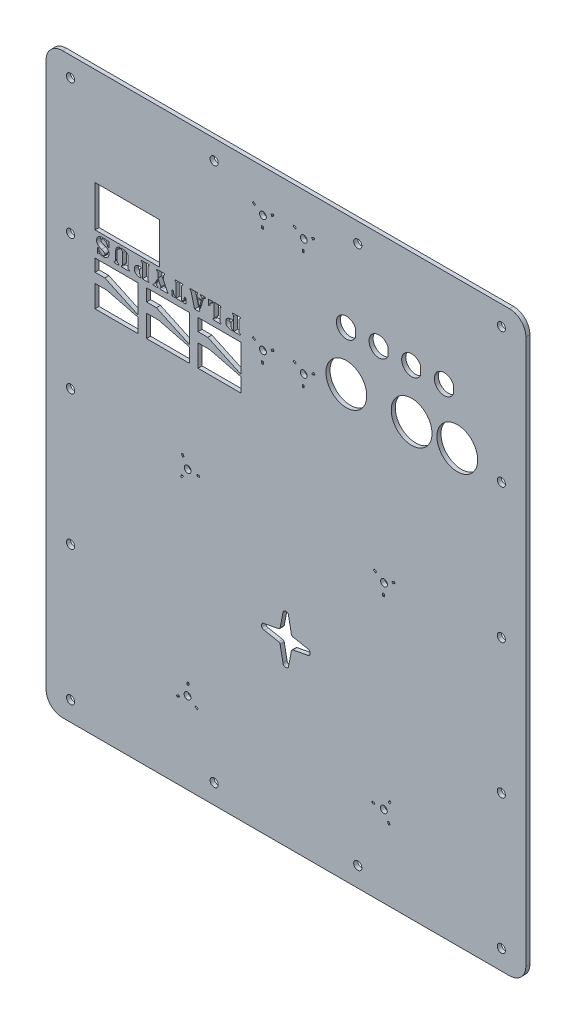
from build123d import *

# Parameters (mm, degrees)
BOSS_EXTRUDE1_DEPTH = 3.175
SKETCH4_R           = 3.175
CUT_EXTRUDE3_DEPTH  = 445.462966308
SKETCH5_W           = 49.9872
SKETCH5_H           = 31.9786
CUT_EXTRUDE4_DEPTH  = 445.462966308
SKETCH10_W          = 1.2954
SKETCH10_H          = 2.080551321
SKETCH10_R          = 2.6543
CUT_EXTRUDE8_DEPTH  = 302.960584479
SKETCH11_W          = 2.080551322
SKETCH11_H          = 1.2954
SKETCH11_W_2        = 1.2954
SKETCH11_H_2        = 2.080551321
SKETCH11_H_3        = 2.080551322
SKETCH11_R          = 2.6543
CUT_EXTRUDE9_DEPTH  = 302.960584479
CUT_EXTRUDE13_DEPTH = 303.360926012
CUT_EXTRUDE11_DEPTH = 445.462966308
SKETCH15_R          = 15.875
SKETCH15_R_2        = 12.7
CUT_EXTRUDE14_DEPTH = 445.462966442


with BuildPart() as part:
    # Sketch1 → Boss-Extrude1 (new body)
    with BuildSketch(Plane.XY):
        with BuildLine():
            Line((174.136860842, 46.306847874), (-173.843139158, 46.306847874))
            ThreePointArc((-173.843139158, 46.306847874), (-182.823395279, 42.587103995), (-186.543139158, 33.606847874))
            Line((-186.543139158, 33.606847874), (-186.543139158, -390.573152126))
            ThreePointArc((-186.543139158, -390.573152126), (-182.823395279, -399.553408247), (-173.843139158, -403.273152126))
            Line((-173.843139158, -403.273152126), (174.136860842, -403.273152126))
            ThreePointArc((174.136860842, -403.273152126), (183.117116963, -399.553408247), (186.836860842, -390.573152126))
            Line((186.836860842, -390.573152126), (186.836860842, 33.606847874))
            ThreePointArc((186.836860842, 33.606847874), (183.117116963, 42.587103995), (174.136860842, 46.306847874))
        make_face()
    extrude(amount=BOSS_EXTRUDE1_DEPTH)

    # Sketch4 → Cut-Extrude3 (cut, through all)
    with BuildSketch(Plane(origin=(0, 0, 0), x_dir=(-1, 0, 0), z_dir=(0, 0, -1))):
        with Locations((167.493139158, 31.066847874)):
            Circle(SKETCH4_R)
        with Locations((167.493139158, -73.708152126)):
            Circle(SKETCH4_R)
        with Locations((167.493139158, -178.483152126)):
            Circle(SKETCH4_R)
        with Locations((167.493139158, -283.258152126)):
            Circle(SKETCH4_R)
        with Locations((167.493139158, -388.033152126)):
            Circle(SKETCH4_R)
        with Locations((55.733139158, -388.033152126)):
            Circle(SKETCH4_R)
        with Locations((-56.026860842, -388.033152126)):
            Circle(SKETCH4_R)
        with Locations((-167.786860842, -388.033152126)):
            Circle(SKETCH4_R)
        with Locations((-167.786860842, -283.258152126)):
            Circle(SKETCH4_R)
        with Locations((-167.786860842, -178.483152126)):
            Circle(SKETCH4_R)
        with Locations((-167.786860842, -73.708152126)):
            Circle(SKETCH4_R)
        with Locations((-167.786860842, 31.066847874)):
            Circle(SKETCH4_R)
        with Locations((-56.026860842, 31.066847874)):
            Circle(SKETCH4_R)
        with Locations((55.733139158, 31.066847874)):
            Circle(SKETCH4_R)
    extrude(amount=-CUT_EXTRUDE3_DEPTH, mode=Mode.SUBTRACT)

    # Sketch5 → Cut-Extrude4 (cut, through all)
    with BuildSketch(Plane.XY.offset(3.175)):
        with Locations((-123.449539158, -45.882452126)):
            Rectangle(SKETCH5_W, SKETCH5_H)
    extrude(amount=-CUT_EXTRUDE4_DEPTH, mode=Mode.SUBTRACT)

    # Sketch10 → Cut-Extrude8 (cut, through all)
    with BuildSketch(Plane(origin=(13.706943598, -177.28638634, 3.175), x_dir=(1, 0, 0), z_dir=(0, 0, 1))):
        Polygon((-37.289591891, 195.125899909), (-39.091402189, 196.16617557), (-39.739102189, 195.044326262), (-37.937291891, 194.004050601), align=None)
        Polygon((-24.642895305, 193.322142198), (-22.841085006, 194.362417859), (-23.488785006, 195.484267167), (-25.290595305, 194.443991506), align=None)
        with Locations((-31.880643598, 182.231384875)):
            Rectangle(SKETCH10_W, SKETCH10_H)
        Polygon((-5.539591891, 195.125899909), (-7.341402189, 196.16617557), (-7.989102189, 195.044326262), (-6.187291891, 194.004050601), align=None)
        Polygon((7.107104695, 193.322142198), (8.908914994, 194.362417859), (8.261214994, 195.484267167), (6.459404695, 194.443991506), align=None)
        with Locations((-0.130643598, 182.231384875)):
            Rectangle(SKETCH10_W, SKETCH10_H)
        Polygon((-37.289591891, 104.066899909), (-39.091402189, 105.10717557), (-39.739102189, 103.985326262), (-37.937291891, 102.945050601), align=None)
        Polygon((-24.642895305, 102.263142198), (-22.841085006, 103.303417859), (-23.488785006, 104.425267167), (-25.290595305, 103.384991506), align=None)
        with Locations((-31.880643598, 91.172384876)):
            Rectangle(SKETCH10_W, SKETCH10_H)
        Polygon((-5.539591891, 104.066899909), (-7.341402189, 105.10717557), (-7.989102189, 103.985326262), (-6.187291891, 102.945050601), align=None)
        Polygon((7.107104695, 102.263142198), (8.908914994, 103.303417859), (8.261214994, 104.425267167), (6.459404695, 103.384991506), align=None)
        with Locations((-0.130643598, 91.172384876)):
            Rectangle(SKETCH10_W, SKETCH10_H)
        with Locations((-31.486943598, 190.573234215)):
            Circle(SKETCH10_R)
        with Locations((0.263056402, 190.573234215)):
            Circle(SKETCH10_R)
        with Locations((-31.486943598, 99.514234215)):
            Circle(SKETCH10_R)
        with Locations((0.263056402, 99.514234215)):
            Circle(SKETCH10_R)
    extrude(amount=-CUT_EXTRUDE8_DEPTH, mode=Mode.SUBTRACT)

    # Sketch11 → Cut-Extrude9 (cut, through all)
    with BuildSketch(Plane(origin=(13.706943598, -177.28638634, 3.175), x_dir=(1, 0, 0), z_dir=(0, 0, 1))):
        with BuildLine():
            ThreePointArc((-15.929443598, -103.063465785), (-13.706943598, -105.285965785), (-11.484443598, -103.063465785))
            Line((-11.484443598, -103.063465785), (-9.330021747, -91.872117682))
            ThreePointArc((-9.330021747, -91.872117682), (-8.911130221, -91.082579163), (-8.121591701, -90.663687637))
            Line((-8.121591701, -90.663687637), (3.069756402, -88.509265785))
            ThreePointArc((3.069756402, -88.509265785), (5.292256402, -86.286765785), (3.069756402, -84.064265785))
            Line((3.069756402, -84.064265785), (-8.121591701, -81.909843934))
            ThreePointArc((-8.121591701, -81.909843934), (-8.911130221, -81.490952408), (-9.330021747, -80.701413888))
            Line((-9.330021747, -80.701413888), (-11.484443598, -69.510065785))
            ThreePointArc((-11.484443598, -69.510065785), (-13.706943598, -67.287565785), (-15.929443598, -69.510065785))
            Line((-15.929443598, -69.510065785), (-18.083865449, -80.701413888))
            ThreePointArc((-18.083865449, -80.701413888), (-18.502756975, -81.490952408), (-19.292295495, -81.909843934))
            Line((-19.292295495, -81.909843934), (-30.483643598, -84.064265785))
            ThreePointArc((-30.483643598, -84.064265785), (-32.706143598, -86.286765785), (-30.483643598, -88.509265785))
            Line((-30.483643598, -88.509265785), (-19.292295495, -90.663687637))
            ThreePointArc((-19.292295495, -90.663687637), (-18.502756975, -91.082579163), (-18.083865449, -91.872117682))
            Line((-18.083865449, -91.872117682), (-15.929443598, -103.063465785))
        make_face()
        Polygon((-92.78802861, -2.963679621), (-93.828304271, -1.161869323), (-94.950153579, -1.809569323), (-93.909877919, -3.611379621), align=None)
        with Locations((-81.697271288, -10.201427914)):
            Rectangle(SKETCH11_W, SKETCH11_H)
        Polygon((-94.591786321, -15.610376207), (-95.632061982, -17.412186506), (-94.510212674, -18.059886506), (-93.469937013, -16.258076207), align=None)
        Polygon((56.96944598, -5.401923062), (55.167635682, -4.361647401), (54.519935682, -5.483496709), (56.32174598, -6.52377237), align=None)
        Polygon((69.616142566, -7.205680773), (71.417952865, -6.165405112), (70.770252865, -5.043555804), (68.968442566, -6.083831465), align=None)
        with Locations((62.378394273, -18.296438096)):
            Rectangle(SKETCH11_W_2, SKETCH11_H_2)
        Polygon((-97.030029762, -165.367850798), (-98.83184006, -166.408126459), (-98.18414006, -167.529975767), (-96.382329762, -166.489700106), align=None)
        Polygon((-84.383333176, -167.171608509), (-82.581522877, -168.21188417), (-81.933822877, -167.090034862), (-83.735633176, -166.049759201), align=None)
        with Locations((-89.792281469, -154.277093475)):
            Rectangle(SKETCH11_W_2, SKETCH11_H_3)
        with Locations((54.283384092, -162.372103656)):
            Rectangle(SKETCH11_W, SKETCH11_H)
        Polygon((67.177899126, -156.963155363), (68.218174787, -155.161345065), (67.096325479, -154.513645065), (66.056049818, -156.315455363), align=None)
        Polygon((65.374141415, -169.609851949), (66.414417076, -171.411662248), (67.536266384, -170.763962248), (66.495990723, -168.962151949), align=None)
        with Locations((-90.039120627, -9.807727914)):
            Circle(SKETCH11_R)
        with Locations((62.772094273, -9.954588756)):
            Circle(SKETCH11_R)
        with Locations((62.625233431, -162.765803656)):
            Circle(SKETCH11_R)
        with Locations((-90.185981469, -162.618942814)):
            Circle(SKETCH11_R)
    extrude(amount=-CUT_EXTRUDE9_DEPTH, mode=Mode.SUBTRACT)

    # Sketch14 → Cut-Extrude13 (cut, through all)
    with BuildSketch(Plane(origin=(13.706943598, -177.28638634, 15.875), x_dir=(1, 0, 0), z_dir=(0, 0, 1))):
        with BuildLine():
            ThreePointArc((128.806917244, 113.692643266), (109.756917244, 109.293234215), (128.806917244, 104.893825163))
            Line((128.806917244, 104.893825163), (128.806917244, 113.692643266))
        make_face()
        with BuildLine():
            ThreePointArc((116.665717244, 150.635691209), (101.882917244, 147.393234215), (116.665717244, 144.15077722))
            Line((116.665717244, 144.15077722), (116.665717244, 150.635691209))
        make_face()
        with BuildLine():
            ThreePointArc((91.265717244, 150.635691209), (76.482917244, 147.393234215), (91.265717244, 144.15077722))
            Line((91.265717244, 144.15077722), (91.265717244, 150.635691209))
        make_face()
        with BuildLine():
            ThreePointArc((93.246917244, 113.692643266), (74.196917244, 109.293234215), (93.246917244, 104.893825163))
            Line((93.246917244, 104.893825163), (93.246917244, 113.692643266))
        make_face()
        with BuildLine():
            ThreePointArc((65.865717244, 150.635691209), (51.082917244, 147.393234215), (65.865717244, 144.15077722))
            Line((65.865717244, 144.15077722), (65.865717244, 150.635691209))
        make_face()
        with BuildLine():
            ThreePointArc((40.465717244, 150.635691209), (25.682917244, 147.393234215), (40.465717244, 144.15077722))
            Line((40.465717244, 144.15077722), (40.465717244, 150.635691209))
        make_face()
        with BuildLine():
            ThreePointArc((42.446917244, 113.692643266), (23.396917244, 109.293234215), (42.446917244, 104.893825163))
            Line((42.446917244, 104.893825163), (42.446917244, 113.692643266))
        make_face()
    extrude(amount=-CUT_EXTRUDE13_DEPTH, mode=Mode.SUBTRACT)

    # Sketch12 → Cut-Extrude11 (cut, through all)
    with BuildSketch(Plane.XY.offset(3.175)):
        Polygon((-34.707986547, -102.505070352), (-34.707986547, -80.813584087), (-68.280739158, -80.813584087), (-68.280739158, -90.405799119), (-60.65056811, -90.405799119), align=None)
        Polygon((-59.015531457, -97.926967723), (-68.280739158, -97.926967723), (-68.280739158, -115.040351359), (-34.707986547, -115.040351359), (-34.707986547, -104.031104561), align=None)
        Polygon((-74.789186547, -102.505070352), (-74.789186547, -80.813584087), (-108.361939158, -80.813584087), (-108.361939158, -90.405799119), (-100.73176811, -90.405799119), align=None)
        Polygon((-99.096731457, -97.926967723), (-108.361939158, -97.926967723), (-108.361939158, -115.040351359), (-74.789186547, -115.040351359), (-74.789186547, -104.031104561), align=None)
        Polygon((-114.870386547, -102.505070352), (-114.870386547, -80.813584087), (-148.443139158, -80.813584087), (-148.443139158, -90.405799119), (-140.81296811, -90.405799119), align=None)
        Polygon((-139.177931457, -97.926967723), (-148.443139158, -97.926967723), (-148.443139158, -115.040351359), (-114.870386547, -115.040351359), (-114.870386547, -104.031104561), align=None)
        with BuildLine():
            Line((-41.380930274, -76.448998178), (-41.37923359, -75.567395974))
            add(Edge.make_bspline(
                [(-41.37923359, -75.567395974), (-41.437136071, -75.557701977), (-41.54803329, -75.539135635), (-41.703036219, -75.492711306), (-41.843810377, -75.442303078), (-41.969216532, -75.378732592), (-42.078802932, -75.303784527), (-42.175261163, -75.220661152), (-42.255562938, -75.126788015), (-42.339496939, -74.98650367), (-42.417921981, -74.79480065), (-42.487285082, -74.550414946), (-42.522325046, -74.287448485), (-42.521080582, -74.107533231), (-42.520442098, -74.015226011)],
                knots=[0, 0, 0, 0, 0.975945456, 1.869170967, 2.688106615, 3.46168993, 4.201177763, 4.892431363, 5.575190918, 6.246583884, 7.604214601, 9.008390706, 10.465126602, 12, 12, 12, 12], degree=3))
            Line((-42.520442098, -74.015226011), (-42.520439808, -71.516336462))
            add(Edge.make_bspline(
                [(-42.520439808, -71.516336462), (-42.523235931, -71.416893662), (-42.528636543, -71.224823426), (-42.503647924, -70.944871252), (-42.445377589, -70.687007787), (-42.381227175, -70.48329237), (-42.302526908, -70.336823994), (-42.226376941, -70.235732165), (-42.128686737, -70.14770687), (-42.014871792, -70.066878368), (-41.882213663, -69.996796921), (-41.731842385, -69.936774393), (-41.563432223, -69.884159143), (-41.443721942, -69.859387936), (-41.380930274, -69.846394688)],
                knots=[0, 0, 0, 0, 1.567465422, 3.027503805, 4.414561471, 5.731454538, 6.376451872, 7.026955594, 7.715652945, 8.440324894, 9.222995422, 10.074042567, 10.989776996, 12, 12, 12, 12], degree=3))
            Line((-41.380930274, -69.846394688), (-41.37923359, -68.964794773))
            add(Edge.make_bspline(
                [(-41.37923359, -68.964794773), (-41.582240377, -68.965911969), (-41.969083268, -68.968040861), (-42.521940982, -68.990216337), (-43.018507313, -69.032687751), (-43.464881639, -69.087608861), (-43.869589824, -69.162065284), (-44.240650039, -69.26126159), (-44.585282109, -69.378493683), (-44.798696343, -69.478711682), (-44.902631425, -69.527518951)],
                knots=[0, 0, 0, 0, 1.353535267, 2.579251195, 3.687978574, 4.675615417, 5.57705981, 6.429006362, 7.234908801, 8, 8, 8, 8], degree=3))
            add(Edge.make_bspline(
                [(-44.902631425, -69.527518951), (-44.980623253, -69.571832411), (-45.134025683, -69.658992727), (-45.349083145, -69.804530403), (-45.547729826, -69.958319819), (-45.731054966, -70.11886958), (-45.895888614, -70.291241125), (-46.043452832, -70.471956154), (-46.176086815, -70.660274328), (-46.329144366, -70.923923025), (-46.483637596, -71.275818792), (-46.616563988, -71.726171833), (-46.691313744, -72.207298437), (-46.699271132, -72.537826831), (-46.703341468, -72.70689762)],
                knots=[0, 0, 0, 0, 0.835929135, 1.644192275, 2.417999588, 3.176706094, 3.91355021, 4.638374527, 5.34982087, 6.058314132, 7.47711624, 8.920232743, 10.42464765, 12, 12, 12, 12], degree=3))
            add(Edge.make_bspline(
                [(-46.703341468, -72.70689762), (-46.699386024, -72.87676759), (-46.691688605, -73.207339894), (-46.615862713, -73.689015241), (-46.484173821, -74.139701331), (-46.329095555, -74.492188363), (-46.176128516, -74.75590332), (-46.043310484, -74.944043048), (-45.896784733, -75.125000616), (-45.729418258, -75.294784308), (-45.548690166, -75.45809835), (-45.348928746, -75.611441713), (-45.134066551, -75.757191603), (-44.980637028, -75.844322475), (-44.902631425, -75.888620964)],
                knots=[0, 0, 0, 0, 1.581750114, 3.078135483, 4.527435443, 5.94544867, 6.653547997, 7.364598763, 8.089020064, 8.820216231, 9.583344864, 10.356721926, 11.164535658, 12, 12, 12, 12], degree=3))
            add(Edge.make_bspline(
                [(-44.902631425, -75.888620964), (-44.798678813, -75.937358154), (-44.585228581, -76.037432256), (-44.241071126, -76.155744844), (-43.868884308, -76.250221268), (-43.465255629, -76.329512689), (-43.018556231, -76.383819605), (-42.521821544, -76.422739805), (-41.96966462, -76.445977544), (-41.583376934, -76.44795948), (-41.380930274, -76.448998178)],
                knots=[0, 0, 0, 0, 0.765526089, 1.571886615, 2.422992847, 3.325928705, 4.314126937, 5.423055588, 6.649468233, 8, 8, 8, 8], degree=3))
        make_face()
        with BuildLine():
            Line((-36.217956948, -74.67642423), (-36.217954658, -66.134772609))
            add(Edge.make_bspline(
                [(-36.217954658, -66.134772609), (-36.220928035, -66.068343504), (-36.226390546, -65.946303906), (-36.214373388, -65.779783148), (-36.193050863, -65.646287525), (-36.156237943, -65.536621411), (-36.080130263, -65.447559317), (-35.963778102, -65.375588473), (-35.805394883, -65.311133113), (-35.684590078, -65.276845855), (-35.617720267, -65.257866623)],
                knots=[0, 0, 0, 0, 1.307174116, 2.401462501, 3.276050378, 3.967045341, 4.644219009, 5.531152094, 6.63340374, 8, 8, 8, 8], degree=3))
            add(Edge.make_bspline(
                [(-35.617720267, -65.257866623), (-35.562142728, -65.240173411), (-35.457481582, -65.206854344), (-35.331724779, -65.106393473), (-35.249709452, -64.97327769), (-35.23577223, -64.872148825), (-35.228504294, -64.819412485)],
                knots=[0, 0, 0, 0, 1.102141025, 2.07550289, 2.996419711, 4, 4, 4, 4], degree=3))
            add(Edge.make_bspline(
                [(-35.228504294, -64.819412485), (-35.235831725, -64.767074533), (-35.249589641, -64.668805271), (-35.312155519, -64.539598883), (-35.405505001, -64.440460387), (-35.526309659, -64.388318605), (-35.642822422, -64.35420914), (-35.742885976, -64.3287759), (-35.820324425, -64.310732073), (-35.864641143, -64.312317755), (-35.882668489, -64.312962785)],
                knots=[0, 0, 0, 0, 1.369732363, 2.571796988, 3.680560114, 4.837094652, 5.944922507, 6.848695873, 7.531667538, 8, 8, 8, 8], degree=3))
            Line((-35.882668489, -64.312962785), (-40.900649798, -64.312960495))
            add(Edge.make_bspline(
                [(-40.900649798, -64.312960495), (-40.920117838, -64.312262343), (-40.966645928, -64.310593777), (-41.047803704, -64.328945628), (-41.151878868, -64.354011449), (-41.272856682, -64.388392105), (-41.397897931, -64.439634919), (-41.494084115, -64.539349813), (-41.559227247, -64.668440995), (-41.574470904, -64.767021164), (-41.582572284, -64.819412485)],
                knots=[0, 0, 0, 0, 0.493429497, 1.17928314, 2.09953813, 3.218357332, 4.382465851, 5.478118586, 6.659723358, 8, 8, 8, 8], degree=3))
            add(Edge.make_bspline(
                [(-41.582572284, -64.819412485), (-41.574488927, -64.872182658), (-41.558949112, -64.973630446), (-41.474264715, -65.107377821), (-41.343130011, -65.207320129), (-41.234819966, -65.240263212), (-41.176943589, -65.257866623)],
                knots=[0, 0, 0, 0, 0.988000148, 1.899376554, 2.877514335, 4, 4, 4, 4], degree=3))
            add(Edge.make_bspline(
                [(-41.176943589, -65.257866623), (-41.107839347, -65.277004061), (-40.98265621, -65.311671752), (-40.817753692, -65.374292664), (-40.698766097, -65.448550698), (-40.617186094, -65.53541255), (-40.578297821, -65.646151434), (-40.55293382, -65.779394211), (-40.546624588, -65.946446791), (-40.549402776, -66.068381783), (-40.550915488, -66.134774899)],
                knots=[0, 0, 0, 0, 1.388758088, 2.515751379, 3.401480337, 4.087729947, 4.773478706, 5.637211551, 6.713471136, 8, 8, 8, 8], degree=3))
            Line((-40.550915488, -66.134774899), (-40.550915488, -76.448995888))
            Line((-40.550915488, -76.448995888), (-35.881706806, -76.448995888))
            add(Edge.make_bspline(
                [(-35.881706806, -76.448995888), (-35.864038396, -76.449370378), (-35.820370463, -76.450295938), (-35.742604008, -76.439689288), (-35.642888895, -76.41443836), (-35.526382329, -76.38334042), (-35.40656446, -76.333249929), (-35.313677415, -76.24016232), (-35.249695304, -76.120228511), (-35.235838389, -76.028573707), (-35.228504294, -75.980063271)],
                knots=[0, 0, 0, 0, 0.473901684, 1.171260288, 2.097409462, 3.232772392, 4.415224696, 5.527878073, 6.691572013, 8, 8, 8, 8], degree=3))
            add(Edge.make_bspline(
                [(-35.228504294, -75.980063271), (-35.236088115, -75.930586149), (-35.250855688, -75.834241961), (-35.330785177, -75.70636956), (-35.46040666, -75.617244953), (-35.562609661, -75.584862203), (-35.617720267, -75.567400553)],
                knots=[0, 0, 0, 0, 0.975936159, 1.900388937, 2.867833258, 4, 4, 4, 4], degree=3))
            add(Edge.make_bspline(
                [(-35.617720267, -75.567400553), (-35.684720896, -75.548728685), (-35.806060847, -75.514913428), (-35.963290692, -75.446944879), (-36.080117839, -75.37544321), (-36.156870653, -75.28576545), (-36.193159766, -75.173411849), (-36.214138769, -75.036855535), (-36.226441681, -74.867238863), (-36.220945583, -74.743636176), (-36.217956948, -74.67642423)],
                knots=[0, 0, 0, 0, 1.352815908, 2.449986173, 3.327975688, 3.998320937, 4.696591479, 5.592341057, 6.690777288, 8, 8, 8, 8], degree=3))
        make_face()
        with BuildLine():
            Line((-55.706891682, -64.312962785), (-55.706891682, -74.62155793))
            add(Edge.make_bspline(
                [(-55.706891682, -74.62155793), (-55.705260906, -74.688286548), (-55.702272282, -74.810576028), (-55.709898751, -74.9783115), (-55.73197861, -75.113311774), (-55.768250263, -75.223937813), (-55.840960628, -75.313989965), (-55.955086295, -75.383365356), (-56.106118547, -75.451517104), (-56.223669028, -75.485428749), (-56.288370967, -75.504094341)],
                knots=[0, 0, 0, 0, 1.325556152, 2.429266153, 3.327451725, 4.039541173, 4.71339264, 5.574331377, 6.664867522, 8, 8, 8, 8], degree=3))
            add(Edge.make_bspline(
                [(-56.288370967, -75.504094341), (-56.343209649, -75.521762406), (-56.445458627, -75.554705242), (-56.568977503, -75.655100538), (-56.649267563, -75.788909071), (-56.663256041, -75.891419936), (-56.670552916, -75.944893153)],
                knots=[0, 0, 0, 0, 1.093495768, 2.038867823, 2.977005538, 4, 4, 4, 4], degree=3))
            add(Edge.make_bspline(
                [(-56.670552916, -75.944893153), (-56.663104301, -75.997138627), (-56.649266829, -76.094196302), (-56.589092011, -76.223695452), (-56.495897241, -76.319419029), (-56.380193766, -76.377405687), (-56.266052644, -76.408873971), (-56.16988848, -76.436932281), (-56.09416161, -76.450780697), (-56.050805206, -76.449521189), (-56.032801443, -76.448998178)],
                knots=[0, 0, 0, 0, 1.393517904, 2.588771774, 3.716788684, 4.865912986, 5.973195346, 6.852583588, 7.523534898, 8, 8, 8, 8], degree=3))
            Line((-56.032801443, -76.448998178), (-51.037683, -76.448995888))
            add(Edge.make_bspline(
                [(-51.037683, -76.448995888), (-51.020000762, -76.449487831), (-50.976192903, -76.450706621), (-50.898533057, -76.436674438), (-50.798935512, -76.409531362), (-50.681622834, -76.376656837), (-50.562012975, -76.321070598), (-50.468769235, -76.222968199), (-50.405058153, -76.094949598), (-50.391664751, -75.997282238), (-50.384480488, -75.944893153)],
                knots=[0, 0, 0, 0, 0.461182122, 1.142581655, 2.048715494, 3.159436771, 4.328121736, 5.439780727, 6.626690173, 8, 8, 8, 8], degree=3))
            add(Edge.make_bspline(
                [(-50.384480488, -75.944893153), (-50.391826065, -75.891480898), (-50.405907908, -75.789086902), (-50.486180024, -75.653374305), (-50.614435359, -75.555529074), (-50.718296719, -75.521986161), (-50.773696461, -75.504094341)],
                knots=[0, 0, 0, 0, 1.013557016, 1.943040115, 2.902815765, 4, 4, 4, 4], degree=3))
            add(Edge.make_bspline(
                [(-50.773696461, -75.504094341), (-50.840758804, -75.485516534), (-50.962210519, -75.451871624), (-51.118374539, -75.383050395), (-51.236677389, -75.314606856), (-51.312788196, -75.224693589), (-51.348849819, -75.11321953), (-51.370219248, -74.978258995), (-51.382391193, -74.810966638), (-51.37691434, -74.68892647), (-51.373933142, -74.622496715)],
                knots=[0, 0, 0, 0, 1.361965232, 2.466555846, 3.342076877, 4.016955784, 4.719948849, 5.606660804, 6.697240939, 8, 8, 8, 8], degree=3))
            Line((-51.373933142, -74.622496715), (-51.373930852, -66.075283362))
            add(Edge.make_bspline(
                [(-51.373930852, -66.075283362), (-51.376846745, -66.009151541), (-51.382248737, -65.8866355), (-51.370639719, -65.719551154), (-51.348523143, -65.584708248), (-51.31280809, -65.473957542), (-51.236670438, -65.384049159), (-51.118377177, -65.315603876), (-50.9622096, -65.246783294), (-50.840758477, -65.213138276), (-50.773696461, -65.19456041)],
                knots=[0, 0, 0, 0, 1.297940117, 2.404568393, 3.276794016, 3.9802722, 4.655616827, 5.531742037, 6.637094905, 8, 8, 8, 8], degree=3))
            add(Edge.make_bspline(
                [(-50.773696461, -65.19456041), (-50.718336835, -65.178277902), (-50.615001741, -65.147884731), (-50.488343688, -65.055531693), (-50.406156811, -64.929851484), (-50.391868571, -64.833871273), (-50.384480488, -64.784242367)],
                knots=[0, 0, 0, 0, 1.129440986, 2.10823123, 3.021814881, 4, 4, 4, 4], degree=3))
            add(Edge.make_bspline(
                [(-50.384480488, -64.784242367), (-50.391814456, -64.735731006), (-50.405671132, -64.644074453), (-50.469654865, -64.524152476), (-50.56253604, -64.431022055), (-50.682376679, -64.381097638), (-50.798805462, -64.349432384), (-50.898842301, -64.325754916), (-50.976493611, -64.311147311), (-51.020635925, -64.312436737), (-51.038644683, -64.312962785)],
                knots=[0, 0, 0, 0, 1.306559829, 2.46859226, 3.579657004, 4.760421017, 5.894162889, 6.818989719, 7.518182759, 8, 8, 8, 8], degree=3))
            Line((-51.038644683, -64.312962785), (-55.706891682, -64.312962785))
        make_face()
        with BuildLine():
            Line((-56.47594493, -65.19456041), (-56.47594264, -64.312962785))
            Line((-56.47594264, -64.312962785), (-60.20866679, -64.312962785))
            Line((-60.20866679, -64.312962785), (-60.20866679, -67.869348634))
            add(Edge.make_bspline(
                [(-60.20866679, -67.869348634), (-60.207884483, -67.945509183), (-60.206392302, -68.090778599), (-60.163020069, -68.265240773), (-60.092763011, -68.381847552), (-60.00776188, -68.444731628), (-59.895548085, -68.480904317), (-59.812698364, -68.487567387), (-59.767867977, -68.491172806)],
                knots=[0, 0, 0, 0, 1.556999123, 2.969836169, 3.61763306, 4.302300491, 5.081366538, 6, 6, 6, 6], degree=3))
            add(Edge.make_bspline(
                [(-59.767867977, -68.491172806), (-59.724077857, -68.490421569), (-59.640059198, -68.488980194), (-59.520546796, -68.474131215), (-59.416042508, -68.442615367), (-59.322741488, -68.401768446), (-59.246196264, -68.336766254), (-59.178225699, -68.25692079), (-59.130277898, -68.151632707), (-59.107236844, -68.074894587), (-59.094946385, -68.033961272)],
                knots=[0, 0, 0, 0, 1.169602037, 2.244076825, 3.201710351, 4.079346337, 4.939939225, 5.859274993, 6.85810374, 8, 8, 8, 8], degree=3))
            add(Edge.make_bspline(
                [(-59.094946385, -68.033961272), (-59.045787121, -67.848257936), (-58.950203956, -67.487184334), (-58.743824147, -66.97880302), (-58.493129908, -66.519414868), (-58.245576059, -66.174494867), (-58.021640484, -65.930991294), (-57.841879618, -65.766864507), (-57.647424019, -65.62178083), (-57.438484505, -65.498314773), (-57.21718974, -65.392565329), (-56.983183304, -65.304169454), (-56.734319178, -65.239855871), (-56.562925158, -65.209808871), (-56.47594493, -65.19456041)],
                knots=[0, 0, 0, 0, 1.673526401, 3.253932951, 4.769553252, 6.227891766, 6.941574541, 7.650655917, 8.347051685, 9.052884366, 9.763012646, 10.483171805, 11.230229486, 12, 12, 12, 12], degree=3))
        make_face()
        with BuildLine():
            Line((-66.948042198, -72.315733095), (-66.526788446, -74.161832281))
            Line((-66.526788446, -74.161832281), (-66.473751633, -74.161832281))
            Line((-66.473751633, -74.161832281), (-64.352279123, -67.058075217))
            add(Edge.make_bspline(
                [(-64.352279123, -67.058075217), (-64.308303109, -66.926039708), (-64.225934101, -66.678731397), (-64.076318825, -66.345741402), (-63.929866579, -66.066582232), (-63.76944565, -65.847502302), (-63.609782485, -65.674581732), (-63.457519747, -65.534900112), (-63.310186715, -65.425299045), (-63.206781122, -65.37676739), (-63.158267355, -65.353998279)],
                knots=[0, 0, 0, 0, 1.55885647, 2.919806689, 4.08813128, 5.085192365, 5.953249072, 6.722292891, 7.400550934, 8, 8, 8, 8], degree=3))
            add(Edge.make_bspline(
                [(-63.158267355, -65.353998279), (-63.069460758, -65.317215403), (-62.908746156, -65.250648891), (-62.713761561, -65.181034796), (-62.586951237, -65.108655292), (-62.523702133, -65.025460788), (-62.485687384, -64.920164405), (-62.480890482, -64.842439061), (-62.478311739, -64.800655088)],
                knots=[0, 0, 0, 0, 1.814832546, 3.284329147, 3.915006187, 4.535229293, 5.21256136, 6, 6, 6, 6], degree=3))
            add(Edge.make_bspline(
                [(-62.478311739, -64.800655088), (-62.48544843, -64.747846266), (-62.498898221, -64.648322879), (-62.578228761, -64.521290865), (-62.691923176, -64.426364424), (-62.890347165, -64.360518652), (-63.147510226, -64.317562831), (-63.355806692, -64.314457231), (-63.45604102, -64.312962785)],
                knots=[0, 0, 0, 0, 0.779233805, 1.468542277, 2.157657205, 2.925509688, 4.52052471, 6, 6, 6, 6], degree=3))
            Line((-63.45604102, -64.312962785), (-65.461472748, -64.312960495))
            add(Edge.make_bspline(
                [(-65.461472748, -64.312960495), (-65.559826269, -64.312280115), (-65.759428324, -64.310899328), (-66.004690185, -64.343522374), (-66.190018994, -64.401021979), (-66.294398966, -64.489264563), (-66.365841592, -64.609492943), (-66.37648985, -64.703432072), (-66.38219484, -64.753761598)],
                knots=[0, 0, 0, 0, 1.538508816, 3.122303281, 3.865783517, 4.534926923, 5.215061557, 6, 6, 6, 6], degree=3))
            add(Edge.make_bspline(
                [(-66.38219484, -64.753761598), (-66.380272282, -64.790902548), (-66.376625908, -64.86134506), (-66.340524135, -64.956448343), (-66.295173142, -65.041158094), (-66.197183386, -65.125266266), (-66.048975217, -65.209069045), (-65.920217161, -65.260970056), (-65.852298395, -65.288347392)],
                knots=[0, 0, 0, 0, 0.819158184, 1.553637139, 2.237282682, 2.923996864, 4.377434825, 6, 6, 6, 6], degree=3))
            add(Edge.make_bspline(
                [(-65.852298395, -65.288347392), (-65.78091391, -65.31660771), (-65.64673428, -65.369727923), (-65.47025031, -65.479616877), (-65.331211278, -65.609003789), (-65.227380994, -65.764868531), (-65.170422536, -65.959573524), (-65.163835199, -66.197705297), (-65.202742989, -66.483610473), (-65.25585589, -66.687094407), (-65.284887158, -66.798317792)],
                knots=[0, 0, 0, 0, 0.99439519, 1.869139766, 2.679476174, 3.441508038, 4.268851848, 5.273785263, 6.509863534, 8, 8, 8, 8], degree=3))
            Line((-65.284887158, -66.798317792), (-66.948042198, -72.315733095))
        make_face()
        with BuildLine():
            Line((-68.841648521, -67.46420307), (-69.195593628, -66.213424533))
            add(Edge.make_bspline(
                [(-69.195593628, -66.213424533), (-69.213629026, -66.143767541), (-69.246692627, -66.016068061), (-69.270400972, -65.837693062), (-69.274228946, -65.692167011), (-69.250091804, -65.571022878), (-69.185574227, -65.473709148), (-69.096720127, -65.382597164), (-68.971407876, -65.30049184), (-68.87657439, -65.249981822), (-68.825345706, -65.222696505)],
                knots=[0, 0, 0, 0, 1.430981437, 2.623363125, 3.572227714, 4.323076296, 5.035393804, 5.860403914, 6.844198436, 8, 8, 8, 8], degree=3))
            add(Edge.make_bspline(
                [(-68.825345706, -65.222696505), (-68.774460545, -65.197125091), (-68.682489117, -65.15090652), (-68.563311927, -65.059986846), (-68.495122682, -64.92489659), (-68.49037096, -64.824177634), (-68.487712572, -64.767829645)],
                knots=[0, 0, 0, 0, 1.123237777, 2.030174989, 2.897966342, 4, 4, 4, 4], degree=3))
            add(Edge.make_bspline(
                [(-68.487712572, -64.767829645), (-68.493116359, -64.720812229), (-68.503356289, -64.631716356), (-68.568565608, -64.51581706), (-68.665361161, -64.427950298), (-68.837570347, -64.362926938), (-69.06956761, -64.315731624), (-69.260401887, -64.313882004), (-69.35524215, -64.312962785)],
                knots=[0, 0, 0, 0, 0.77012511, 1.459352198, 2.131770764, 2.873136646, 4.446020556, 6, 6, 6, 6], degree=3))
            Line((-69.35524215, -64.312962785), (-73.761485509, -64.312960495))
            add(Edge.make_bspline(
                [(-73.761485509, -64.312960495), (-73.859843308, -64.312589013), (-74.065495216, -64.311812296), (-74.320765567, -64.342514048), (-74.518772358, -64.396546855), (-74.635946343, -64.47896024), (-74.711415816, -64.598279686), (-74.727704336, -64.689419766), (-74.736270208, -64.737348876)],
                knots=[0, 0, 0, 0, 1.49801841, 3.132139453, 3.908140131, 4.59912247, 5.263300911, 6, 6, 6, 6], degree=3))
            add(Edge.make_bspline(
                [(-74.736270208, -64.737348876), (-74.734612256, -64.771188946), (-74.73147238, -64.835276201), (-74.70414361, -64.924138485), (-74.665044222, -65.001138822), (-74.588180059, -65.084906479), (-74.46338702, -65.167613991), (-74.351850608, -65.214450054), (-74.293126721, -65.239109226)],
                knots=[0, 0, 0, 0, 0.842890591, 1.596289387, 2.303525048, 2.981050027, 4.410523737, 6, 6, 6, 6], degree=3))
            add(Edge.make_bspline(
                [(-74.293126721, -65.239109226), (-74.238069266, -65.262880897), (-74.134477047, -65.307607994), (-74.004629165, -65.401426964), (-73.900493473, -65.501729301), (-73.812122462, -65.664282511), (-73.734694272, -65.896338595), (-73.695263069, -66.092800792), (-73.674132644, -66.198081111)],
                knots=[0, 0, 0, 0, 0.889651735, 1.673905862, 2.373065064, 3.019434396, 4.402772122, 6, 6, 6, 6], degree=3))
            Line((-73.674132644, -66.198081111), (-71.018410929, -76.448995888))
            Line((-71.018410929, -76.448995888), (-67.107317496, -76.448995888))
            Line((-67.107317496, -76.448995888), (-66.877253177, -75.566828123))
            Line((-66.877253177, -75.566828123), (-68.664675967, -68.345802985))
            Line((-68.664675967, -68.345802985), (-66.505610814, -68.345802985))
            Line((-66.505610814, -68.345802985), (-66.257849239, -67.46420307))
            Line((-66.257849239, -67.46420307), (-68.841648521, -67.46420307))
        make_face()
        with BuildLine():
            Line((-81.085646559, -76.448995888), (-81.085646559, -66.139645136))
            add(Edge.make_bspline(
                [(-81.085646559, -66.139645136), (-81.088779485, -66.073123284), (-81.094532703, -65.950964406), (-81.080675152, -65.784100796), (-81.064164376, -65.648983882), (-81.02579824, -65.539877431), (-80.954050836, -65.450284075), (-80.839751044, -65.380952261), (-80.688783226, -65.312784388), (-80.57122206, -65.278875417), (-80.506514239, -65.260211297)],
                knots=[0, 0, 0, 0, 1.324262851, 2.431839467, 3.329812515, 4.029198411, 4.704809645, 5.567996729, 6.661380815, 8, 8, 8, 8], degree=3))
            add(Edge.make_bspline(
                [(-80.506514239, -65.260211297), (-80.451742256, -65.241593864), (-80.349859048, -65.206962951), (-80.225848784, -65.106979618), (-80.146074618, -64.97369173), (-80.13175199, -64.872061204), (-80.12433229, -64.819412485)],
                knots=[0, 0, 0, 0, 1.10158363, 2.049092769, 2.989351214, 4, 4, 4, 4], degree=3))
            add(Edge.make_bspline(
                [(-80.12433229, -64.819412485), (-80.131920668, -64.767213716), (-80.146119631, -64.669542208), (-80.205161502, -64.538885327), (-80.298421598, -64.44210195), (-80.415378628, -64.387563793), (-80.528692053, -64.354865605), (-80.625331543, -64.328499236), (-80.700503303, -64.310675742), (-80.744054319, -64.312293188), (-80.762083763, -64.312962785)],
                knots=[0, 0, 0, 0, 1.391318025, 2.603358897, 3.729595061, 4.867357472, 5.97289182, 6.850891814, 7.52428707, 8, 8, 8, 8], degree=3))
            Line((-80.762083763, -64.312962785), (-85.743326495, -64.312960495))
            add(Edge.make_bspline(
                [(-85.743326495, -64.312960495), (-85.761754673, -64.312268733), (-85.805705345, -64.310618901), (-85.881270489, -64.3284849), (-85.977908431, -64.354871093), (-86.091222414, -64.38756213), (-86.20817928, -64.442102394), (-86.30143942, -64.538885199), (-86.360481278, -64.669542247), (-86.374680244, -64.767213729), (-86.382268623, -64.819412485)],
                knots=[0, 0, 0, 0, 0.485578589, 1.158090905, 2.034939688, 3.139024486, 4.275295091, 5.400054563, 6.610506237, 8, 8, 8, 8], degree=3))
            add(Edge.make_bspline(
                [(-86.382268623, -64.819412485), (-86.374848923, -64.872061204), (-86.360526294, -64.97369173), (-86.280752129, -65.106979618), (-86.156741865, -65.206962951), (-86.054858657, -65.241593864), (-86.000086674, -65.260211297)],
                knots=[0, 0, 0, 0, 1.010648786, 1.950907231, 2.89841637, 4, 4, 4, 4], degree=3))
            add(Edge.make_bspline(
                [(-86.000086674, -65.260211297), (-85.935381647, -65.278875823), (-85.817825558, -65.312785534), (-85.666827128, -65.38094895), (-85.55261006, -65.450292807), (-85.48062848, -65.539852074), (-85.443158076, -65.649217998), (-85.421766076, -65.783706021), (-85.413926184, -65.951834751), (-85.416951401, -66.074605073), (-85.418607389, -66.141808922)],
                knots=[0, 0, 0, 0, 1.336004151, 2.427252278, 3.2887531, 3.963044506, 4.66106413, 5.559836104, 6.664266688, 8, 8, 8, 8], degree=3))
            Line((-85.418607389, -66.141808922), (-85.418607389, -76.448995888))
            Line((-85.418607389, -76.448995888), (-81.085646559, -76.448995888))
        make_face()
        with BuildLine():
            Line((-88.719909135, -72.713931644), (-88.719909135, -76.448995888))
            Line((-88.719909135, -76.448995888), (-86.187658347, -76.448995888))
            Line((-86.187658347, -76.448995888), (-86.187658347, -75.567395974))
            add(Edge.make_bspline(
                [(-86.187658347, -75.567395974), (-86.293438068, -75.486736448), (-86.500523295, -75.328829089), (-86.762888207, -75.044282429), (-86.979635849, -74.734484492), (-87.137530227, -74.395596605), (-87.261467115, -74.04980618), (-87.363479975, -73.704677358), (-87.451262482, -73.36444372), (-87.489026597, -73.136309975), (-87.5077124, -73.023428683)],
                knots=[0, 0, 0, 0, 1.080164805, 2.114641384, 3.133828854, 4.143155398, 5.144644344, 6.120070999, 7.069805239, 8, 8, 8, 8], degree=3))
            add(Edge.make_bspline(
                [(-87.5077124, -73.023428683), (-87.521342687, -72.931093945), (-87.54817581, -72.749320113), (-87.632769149, -72.536942135), (-87.728439527, -72.38437944), (-87.842593005, -72.305648167), (-87.981641417, -72.252583816), (-88.08549963, -72.244571606), (-88.140774525, -72.240307388)],
                knots=[0, 0, 0, 0, 1.491813835, 2.936843961, 3.639024131, 4.338291144, 5.115613697, 6, 6, 6, 6], degree=3))
            add(Edge.make_bspline(
                [(-88.140774525, -72.240307388), (-88.19907738, -72.244894625), (-88.305858639, -72.253296117), (-88.447170582, -72.299013402), (-88.559801551, -72.360362938), (-88.629745378, -72.448351225), (-88.671185228, -72.534556346), (-88.70137937, -72.606349056), (-88.722837766, -72.664327342), (-88.720792373, -72.698971616), (-88.719909135, -72.713931644)],
                knots=[0, 0, 0, 0, 1.67952497, 3.076037854, 4.258393786, 5.314195674, 6.251302968, 7.008668416, 7.571924998, 8, 8, 8, 8], degree=3))
        make_face()
        with BuildLine():
            Line((-77.784347104, -76.448995888), (-77.784347104, -72.712447905))
            add(Edge.make_bspline(
                [(-77.784347104, -72.712447905), (-77.78463524, -72.698042717), (-77.785310892, -72.664263978), (-77.801077361, -72.605327311), (-77.836788393, -72.535381696), (-77.87632213, -72.44810654), (-77.946697804, -72.361260267), (-78.057977417, -72.297753155), (-78.200220808, -72.253874145), (-78.30760214, -72.245077241), (-78.365826388, -72.240307388)],
                knots=[0, 0, 0, 0, 0.414862822, 0.972812258, 1.739972012, 2.678056995, 3.734960406, 4.899268022, 6.318722774, 8, 8, 8, 8], degree=3))
            add(Edge.make_bspline(
                [(-78.365826388, -72.240307388), (-78.421101282, -72.244571606), (-78.524959496, -72.252583816), (-78.664007908, -72.305648167), (-78.778161386, -72.38437944), (-78.873831764, -72.536942135), (-78.958425103, -72.749320113), (-78.985258226, -72.931093945), (-78.998888513, -73.023428683)],
                knots=[0, 0, 0, 0, 0.884386303, 1.661708856, 2.360975869, 3.063156039, 4.508186165, 6, 6, 6, 6], degree=3))
            add(Edge.make_bspline(
                [(-78.998888513, -73.023428683), (-79.017876295, -73.13623217), (-79.056219855, -73.36402535), (-79.139298775, -73.705511557), (-79.246139065, -74.049263877), (-79.368638203, -74.395780861), (-79.527411631, -74.733676784), (-79.741040506, -75.045032309), (-80.003900453, -75.328716228), (-80.210873195, -75.486701248), (-80.316595601, -75.567400553)],
                knots=[0, 0, 0, 0, 0.930574143, 1.879183428, 2.856850479, 3.858747885, 4.868486085, 5.884493158, 6.91939165, 8, 8, 8, 8], degree=3))
            Line((-80.316595601, -75.567400553), (-80.316595601, -76.448995888))
            Line((-80.316595601, -76.448995888), (-77.784347104, -76.448995888))
        make_face()
        with BuildLine():
            Line((-99.418345346, -71.922468895), (-99.895811754, -70.770496408))
            Line((-99.895811754, -70.770496408), (-101.718988542, -74.258863798))
            add(Edge.make_bspline(
                [(-101.718988542, -74.258863798), (-101.758133535, -74.335077077), (-101.832491109, -74.479847435), (-101.948862705, -74.681775019), (-102.070417165, -74.852929402), (-102.198209524, -75.001380334), (-102.348976647, -75.1271277), (-102.525693369, -75.245120736), (-102.738447414, -75.351713374), (-102.893724756, -75.413124134), (-102.975530307, -75.445477477)],
                knots=[0, 0, 0, 0, 1.151203723, 2.186760311, 3.127929962, 3.968597285, 4.810313313, 5.756857114, 6.818233627, 8, 8, 8, 8], degree=3))
            add(Edge.make_bspline(
                [(-102.975530307, -75.445477477), (-103.037575562, -75.46515261), (-103.154146369, -75.502118306), (-103.294726749, -75.613786141), (-103.391990399, -75.758977065), (-103.409586354, -75.872299618), (-103.418673794, -75.930825106)],
                knots=[0, 0, 0, 0, 1.100399957, 2.067434687, 3.001925693, 4, 4, 4, 4], degree=3))
            add(Edge.make_bspline(
                [(-103.418673794, -75.930825106), (-103.413214686, -75.984744107), (-103.403039655, -76.085241735), (-103.341490296, -76.217931953), (-103.248999269, -76.322767801), (-103.071205826, -76.398337024), (-102.824579028, -76.447443186), (-102.62020274, -76.448472993), (-102.515974098, -76.448998178)],
                knots=[0, 0, 0, 0, 0.819555152, 1.527538495, 2.192635646, 2.894998392, 4.4164988, 6, 6, 6, 6], degree=3))
            Line((-102.515974098, -76.448998178), (-100.550969688, -76.448995888))
            add(Edge.make_bspline(
                [(-100.550969688, -76.448995888), (-100.43141673, -76.452567605), (-100.186245072, -76.459892256), (-99.881949857, -76.437507524), (-99.648597037, -76.380734158), (-99.511804743, -76.278800963), (-99.4258649, -76.127246477), (-99.410499449, -76.010138949), (-99.402246316, -75.947237828)],
                knots=[0, 0, 0, 0, 1.513393915, 3.103572674, 3.858014825, 4.515060911, 5.202405379, 6, 6, 6, 6], degree=3))
            add(Edge.make_bspline(
                [(-99.402246316, -75.947237828), (-99.409756072, -75.913321176), (-99.424464163, -75.84689436), (-99.464539512, -75.754345999), (-99.520828841, -75.673150273), (-99.587493239, -75.599192946), (-99.673465237, -75.541120124), (-99.769136765, -75.488417716), (-99.881118074, -75.449195224), (-100.002578319, -75.421991028), (-100.126047111, -75.3944457), (-100.238623889, -75.340749289), (-100.336859776, -75.270702931), (-100.421844781, -75.183867144), (-100.490239967, -75.078488898), (-100.543379939, -74.955437629), (-100.583632, -74.81591873), (-100.597718594, -74.716529509), (-100.605064352, -74.664700857)],
                knots=[0, 0, 0, 0, 0.875736888, 1.715157864, 2.525074805, 3.362638653, 4.211284313, 5.129340963, 6.115476812, 7.192197053, 8.273787315, 9.297690059, 10.316064851, 11.306730155, 12.346479056, 13.468351247, 14.679817178, 16, 16, 16, 16], degree=3))
            add(Edge.make_bspline(
                [(-100.605064352, -74.664700857), (-100.598684485, -74.58775137), (-100.586106769, -74.436047795), (-100.528657628, -74.215491959), (-100.451236843, -74.003224381), (-100.377152364, -73.872101026), (-100.34011613, -73.806549977)],
                knots=[0, 0, 0, 0, 1.019801683, 2.010508031, 3.005415273, 4, 4, 4, 4], degree=3))
            Line((-100.34011613, -73.806549977), (-99.418345346, -71.922468895))
        make_face()
        with BuildLine():
            Line((-95.191208561, -69.018200231), (-95.191208561, -66.130156531))
            add(Edge.make_bspline(
                [(-95.191208561, -66.130156531), (-95.194190737, -66.064478587), (-95.199698176, -65.943185474), (-95.187336948, -65.776721348), (-95.166659104, -65.642284297), (-95.129399893, -65.532046595), (-95.053979837, -65.442741504), (-94.936135559, -65.373834225), (-94.778823197, -65.308525094), (-94.657906126, -65.274407349), (-94.59097417, -65.255521948)],
                knots=[0, 0, 0, 0, 1.293607948, 2.389017176, 3.279655494, 3.97135822, 4.649225494, 5.528623335, 6.632003982, 8, 8, 8, 8], degree=3))
            add(Edge.make_bspline(
                [(-94.59097417, -65.255521948), (-94.535396631, -65.237828737), (-94.430735485, -65.204509669), (-94.304978683, -65.104048798), (-94.222963355, -64.970933016), (-94.209026133, -64.869804151), (-94.201758197, -64.81706781)],
                knots=[0, 0, 0, 0, 1.102141025, 2.07550289, 2.996419711, 4, 4, 4, 4], degree=3))
            add(Edge.make_bspline(
                [(-94.201758197, -64.81706781), (-94.208931933, -64.76465726), (-94.222305707, -64.666949884), (-94.286146074, -64.539194872), (-94.378691771, -64.440428186), (-94.49958115, -64.388327041), (-94.616072597, -64.354207351), (-94.716140551, -64.328776222), (-94.793578234, -64.310732027), (-94.837895019, -64.312317741), (-94.855922393, -64.312962785)],
                knots=[0, 0, 0, 0, 1.372863706, 2.559387583, 3.67068545, 4.82986394, 5.940224398, 6.846063878, 7.530596884, 8, 8, 8, 8], degree=3))
            Line((-94.855922393, -64.312962785), (-99.860417243, -64.312960495))
            add(Edge.make_bspline(
                [(-99.860417243, -64.312960495), (-99.878908457, -64.312290347), (-99.923690159, -64.310667394), (-100.001585693, -64.328759238), (-100.101651825, -64.354213694), (-100.218143919, -64.388325106), (-100.339033107, -64.440428688), (-100.431578854, -64.539194731), (-100.495419207, -64.666949927), (-100.508792984, -64.764657275), (-100.51596672, -64.81706781)],
                knots=[0, 0, 0, 0, 0.480736481, 1.164239281, 2.068715495, 3.177404888, 4.334838842, 5.444464233, 6.629202421, 8, 8, 8, 8], degree=3))
            add(Edge.make_bspline(
                [(-100.51596672, -64.81706781), (-100.508698784, -64.869804151), (-100.494761562, -64.970933016), (-100.412746235, -65.104048798), (-100.286989432, -65.204509669), (-100.182328286, -65.237828737), (-100.126750747, -65.255521948)],
                knots=[0, 0, 0, 0, 1.003580289, 1.92449711, 2.897858975, 4, 4, 4, 4], degree=3))
            add(Edge.make_bspline(
                [(-100.126750747, -65.255521948), (-100.0598217, -65.274407812), (-99.938909881, -65.308526394), (-99.781566041, -65.373830511), (-99.663806926, -65.442751353), (-99.588149563, -65.53201865), (-99.551779239, -65.64254122), (-99.526234035, -65.776296585), (-99.519872747, -65.944096728), (-99.522654655, -66.066035209), (-99.524169392, -66.132430224)],
                knots=[0, 0, 0, 0, 1.365186676, 2.4663014, 3.343893293, 4.020368486, 4.710650719, 5.602242303, 6.694430521, 8, 8, 8, 8], degree=3))
            Line((-99.524169392, -66.132430224), (-99.524169392, -69.878123355))
            Line((-99.524169392, -69.878123355), (-97.331191178, -74.469788338))
            add(Edge.make_bspline(
                [(-97.331191178, -74.469788338), (-97.285219548, -74.569137882), (-97.194312355, -74.765597919), (-97.168705579, -74.980510607), (-97.156048111, -75.086742273)],
                knots=[0, 0, 0, 0, 1.011396986, 2, 2, 2, 2], degree=3))
            add(Edge.make_bspline(
                [(-97.156048111, -75.086742273), (-97.158998539, -75.135930653), (-97.164451523, -75.226840673), (-97.246888629, -75.339226479), (-97.362586568, -75.410633874), (-97.446475123, -75.453196725), (-97.49133657, -75.475958246)],
                knots=[0, 0, 0, 0, 1.053530958, 1.947137115, 2.902181613, 4, 4, 4, 4], degree=3))
            add(Edge.make_bspline(
                [(-97.49133657, -75.475958246), (-97.539834187, -75.504455993), (-97.635249702, -75.560523228), (-97.761366971, -75.663367784), (-97.859899114, -75.798671983), (-97.873493811, -75.907265751), (-97.880552543, -75.963650549)],
                knots=[0, 0, 0, 0, 1.02936382, 2.025198071, 2.974629847, 4, 4, 4, 4], degree=3))
            add(Edge.make_bspline(
                [(-97.880552543, -75.963650549), (-97.873669801, -76.01987722), (-97.860902037, -76.124179965), (-97.794063808, -76.262872795), (-97.681335995, -76.358891674), (-97.487063455, -76.423341115), (-97.225173886, -76.453419183), (-97.013053959, -76.450467035), (-96.907512611, -76.448998178)],
                knots=[0, 0, 0, 0, 0.820811381, 1.522638255, 2.183762156, 2.91447535, 4.464781516, 6, 6, 6, 6], degree=3))
            Line((-96.907512611, -76.448998178), (-92.536620259, -76.448995888))
            add(Edge.make_bspline(
                [(-92.536620259, -76.448995888), (-92.435912393, -76.450295829), (-92.2326087, -76.452920079), (-91.981213651, -76.424663299), (-91.793303592, -76.363057818), (-91.683871549, -76.27026419), (-91.619195157, -76.135617673), (-91.60620308, -76.03469858), (-91.599169464, -75.980063271)],
                knots=[0, 0, 0, 0, 1.520000785, 3.068496902, 3.800411896, 4.469735487, 5.171549486, 6, 6, 6, 6], degree=3))
            add(Edge.make_bspline(
                [(-91.599169464, -75.980063271), (-91.601343171, -75.948696266), (-91.605418679, -75.889885903), (-91.625744655, -75.806820818), (-91.663706177, -75.737858452), (-91.734844859, -75.662527215), (-91.850860257, -75.585894372), (-91.95261935, -75.535685876), (-92.007142833, -75.50878369)],
                knots=[0, 0, 0, 0, 0.846640738, 1.587376536, 2.284936902, 2.940877257, 4.360893131, 6, 6, 6, 6], degree=3))
            add(Edge.make_bspline(
                [(-92.007142833, -75.50878369), (-92.073060125, -75.464995545), (-92.196500942, -75.382995145), (-92.336618211, -75.215576225), (-92.434378214, -75.027808549), (-92.490995684, -74.897188402), (-92.520626556, -74.828828074)],
                knots=[0, 0, 0, 0, 1.086980604, 2.035547428, 2.971899642, 4, 4, 4, 4], degree=3))
            Line((-92.520626556, -74.828828074), (-95.191208561, -69.018200231))
        make_face()
        with BuildLine():
            Line((-112.508976966, -76.448998178), (-112.507280283, -75.567395974))
            add(Edge.make_bspline(
                [(-112.507280283, -75.567395974), (-112.565182764, -75.557701977), (-112.676079982, -75.539135635), (-112.831082912, -75.492711306), (-112.97185707, -75.442303078), (-113.097263225, -75.378732592), (-113.206849625, -75.303784527), (-113.303307856, -75.220661152), (-113.383609631, -75.126788015), (-113.467543632, -74.98650367), (-113.545968674, -74.79480065), (-113.615331774, -74.550414946), (-113.650371739, -74.287448485), (-113.649127274, -74.107533231), (-113.64848879, -74.015226011)],
                knots=[0, 0, 0, 0, 0.975945456, 1.869170967, 2.688106615, 3.46168993, 4.201177763, 4.892431363, 5.575190918, 6.246583884, 7.604214601, 9.008390706, 10.465126602, 12, 12, 12, 12], degree=3))
            Line((-113.64848879, -74.015226011), (-113.648486501, -71.516336462))
            add(Edge.make_bspline(
                [(-113.648486501, -71.516336462), (-113.651282624, -71.416893662), (-113.656683236, -71.224823426), (-113.631694617, -70.944871252), (-113.573424281, -70.687007787), (-113.509273868, -70.48329237), (-113.430573601, -70.336823994), (-113.354423633, -70.235732165), (-113.25673343, -70.14770687), (-113.142918485, -70.066878368), (-113.010260356, -69.996796921), (-112.859889077, -69.936774393), (-112.691478916, -69.884159143), (-112.571768635, -69.859387936), (-112.508976966, -69.846394688)],
                knots=[0, 0, 0, 0, 1.567465422, 3.027503805, 4.414561471, 5.731454538, 6.376451872, 7.026955594, 7.715652945, 8.440324894, 9.222995422, 10.074042567, 10.989776996, 12, 12, 12, 12], degree=3))
            Line((-112.508976966, -69.846394688), (-112.507280283, -68.964794773))
            add(Edge.make_bspline(
                [(-112.507280283, -68.964794773), (-112.710287069, -68.965911969), (-113.097129961, -68.968040861), (-113.649987675, -68.990216337), (-114.146554005, -69.032687751), (-114.592928332, -69.087608861), (-114.997636516, -69.162065284), (-115.368696732, -69.26126159), (-115.713328801, -69.378493683), (-115.926743036, -69.478711682), (-116.030678118, -69.527518951)],
                knots=[0, 0, 0, 0, 1.353535267, 2.579251195, 3.687978574, 4.675615417, 5.57705981, 6.429006362, 7.234908801, 8, 8, 8, 8], degree=3))
            add(Edge.make_bspline(
                [(-116.030678118, -69.527518951), (-116.108669945, -69.571832411), (-116.262072375, -69.658992727), (-116.477129838, -69.804530403), (-116.675776519, -69.958319819), (-116.859101659, -70.11886958), (-117.023935307, -70.291241125), (-117.171499525, -70.471956154), (-117.304133507, -70.660274328), (-117.457191058, -70.923923025), (-117.611684289, -71.275818792), (-117.744610681, -71.726171833), (-117.819360437, -72.207298437), (-117.827317824, -72.537826831), (-117.831388161, -72.70689762)],
                knots=[0, 0, 0, 0, 0.835929135, 1.644192275, 2.417999588, 3.176706094, 3.91355021, 4.638374527, 5.34982087, 6.058314132, 7.47711624, 8.920232743, 10.42464765, 12, 12, 12, 12], degree=3))
            add(Edge.make_bspline(
                [(-117.831388161, -72.70689762), (-117.827432717, -72.87676759), (-117.819735298, -73.207339894), (-117.743909406, -73.689015241), (-117.612220514, -74.139701331), (-117.457142248, -74.492188363), (-117.304175209, -74.75590332), (-117.171357177, -74.944043048), (-117.024831425, -75.125000616), (-116.857464951, -75.294784308), (-116.676736858, -75.45809835), (-116.476975439, -75.611441713), (-116.262113244, -75.757191603), (-116.10868372, -75.844322475), (-116.030678118, -75.888620964)],
                knots=[0, 0, 0, 0, 1.581750114, 3.078135483, 4.527435443, 5.94544867, 6.653547997, 7.364598763, 8.089020064, 8.820216231, 9.583344864, 10.356721926, 11.164535658, 12, 12, 12, 12], degree=3))
            add(Edge.make_bspline(
                [(-116.030678118, -75.888620964), (-115.926725505, -75.937358154), (-115.713275274, -76.037432256), (-115.369117818, -76.155744844), (-114.996931001, -76.250221268), (-114.593302322, -76.329512689), (-114.146602924, -76.383819605), (-113.649868237, -76.422739805), (-113.097711312, -76.445977544), (-112.711423627, -76.44795948), (-112.508976966, -76.448998178)],
                knots=[0, 0, 0, 0, 0.765526089, 1.571886615, 2.422992847, 3.325928705, 4.314126937, 5.423055588, 6.649468233, 8, 8, 8, 8], degree=3))
        make_face()
        with BuildLine():
            Line((-107.34600364, -74.67642423), (-107.346001351, -66.134772609))
            add(Edge.make_bspline(
                [(-107.346001351, -66.134772609), (-107.348974727, -66.068343504), (-107.354437238, -65.946303906), (-107.34242008, -65.779783148), (-107.321097556, -65.646287525), (-107.284284636, -65.536621411), (-107.208176956, -65.447559317), (-107.091824795, -65.375588473), (-106.933441576, -65.311133113), (-106.812636771, -65.276845855), (-106.745766959, -65.257866623)],
                knots=[0, 0, 0, 0, 1.307174116, 2.401462501, 3.276050378, 3.967045341, 4.644219009, 5.531152094, 6.63340374, 8, 8, 8, 8], degree=3))
            add(Edge.make_bspline(
                [(-106.745766959, -65.257866623), (-106.69018942, -65.240173411), (-106.585528274, -65.206854344), (-106.459771472, -65.106393473), (-106.377756144, -64.97327769), (-106.363818922, -64.872148825), (-106.356550987, -64.819412485)],
                knots=[0, 0, 0, 0, 1.102141025, 2.07550289, 2.996419711, 4, 4, 4, 4], degree=3))
            add(Edge.make_bspline(
                [(-106.356550987, -64.819412485), (-106.363878417, -64.767074533), (-106.377636334, -64.668805271), (-106.440202212, -64.539598883), (-106.533551694, -64.440460387), (-106.654356352, -64.388318605), (-106.770869114, -64.35420914), (-106.870932669, -64.3287759), (-106.948371118, -64.310732073), (-106.992687836, -64.312317755), (-107.010715182, -64.312962785)],
                knots=[0, 0, 0, 0, 1.369732363, 2.571796988, 3.680560114, 4.837094652, 5.944922507, 6.848695873, 7.531667538, 8, 8, 8, 8], degree=3))
            Line((-107.010715182, -64.312962785), (-112.028696491, -64.312960495))
            add(Edge.make_bspline(
                [(-112.028696491, -64.312960495), (-112.048164531, -64.312262343), (-112.09469262, -64.310593777), (-112.175850396, -64.328945628), (-112.279925561, -64.354011449), (-112.400903375, -64.388392105), (-112.525944623, -64.439634919), (-112.622130807, -64.539349813), (-112.687273939, -64.668440995), (-112.702517597, -64.767021164), (-112.710618976, -64.819412485)],
                knots=[0, 0, 0, 0, 0.493429497, 1.17928314, 2.09953813, 3.218357332, 4.382465851, 5.478118586, 6.659723358, 8, 8, 8, 8], degree=3))
            add(Edge.make_bspline(
                [(-112.710618976, -64.819412485), (-112.702535619, -64.872182658), (-112.686995805, -64.973630446), (-112.602311408, -65.107377821), (-112.471176704, -65.207320129), (-112.362866658, -65.240263212), (-112.304990282, -65.257866623)],
                knots=[0, 0, 0, 0, 0.988000148, 1.899376554, 2.877514335, 4, 4, 4, 4], degree=3))
            add(Edge.make_bspline(
                [(-112.304990282, -65.257866623), (-112.235886039, -65.277004061), (-112.110702903, -65.311671752), (-111.945800384, -65.374292664), (-111.82681279, -65.448550698), (-111.745232786, -65.53541255), (-111.706344513, -65.646151434), (-111.680980512, -65.779394211), (-111.67467128, -65.946446791), (-111.677449469, -66.068381783), (-111.678962181, -66.134774899)],
                knots=[0, 0, 0, 0, 1.388758088, 2.515751379, 3.401480337, 4.087729947, 4.773478706, 5.637211551, 6.713471136, 8, 8, 8, 8], degree=3))
            Line((-111.678962181, -66.134774899), (-111.678962181, -76.448995888))
            Line((-111.678962181, -76.448995888), (-107.009753499, -76.448995888))
            add(Edge.make_bspline(
                [(-107.009753499, -76.448995888), (-106.992085089, -76.449370378), (-106.948417156, -76.450295938), (-106.870650701, -76.439689288), (-106.770935588, -76.41443836), (-106.654429022, -76.38334042), (-106.534611153, -76.333249929), (-106.441724107, -76.24016232), (-106.377741997, -76.120228511), (-106.363885081, -76.028573707), (-106.356550987, -75.980063271)],
                knots=[0, 0, 0, 0, 0.473901684, 1.171260288, 2.097409462, 3.232772392, 4.415224696, 5.527878073, 6.691572013, 8, 8, 8, 8], degree=3))
            add(Edge.make_bspline(
                [(-106.356550987, -75.980063271), (-106.364134807, -75.930586149), (-106.37890238, -75.834241961), (-106.458831869, -75.70636956), (-106.588453353, -75.617244953), (-106.690656353, -75.584862203), (-106.745766959, -75.567400553)],
                knots=[0, 0, 0, 0, 0.975936159, 1.900388937, 2.867833258, 4, 4, 4, 4], degree=3))
            add(Edge.make_bspline(
                [(-106.745766959, -75.567400553), (-106.812767589, -75.548728685), (-106.934107539, -75.514913428), (-107.091337384, -75.446944879), (-107.208164532, -75.37544321), (-107.284917346, -75.28576545), (-107.321206459, -75.173411849), (-107.342185462, -75.036855535), (-107.354488373, -74.867238863), (-107.348992276, -74.743636176), (-107.34600364, -74.67642423)],
                knots=[0, 0, 0, 0, 1.352815908, 2.449986173, 3.327975688, 3.998320937, 4.696591479, 5.592341057, 6.690777288, 8, 8, 8, 8], degree=3))
        make_face()
        with BuildLine():
            Line((-131.360160227, -73.855788142), (-131.358076581, -67.701017488))
            add(Edge.make_bspline(
                [(-131.358076581, -67.701017488), (-131.352378541, -67.612556944), (-131.341185367, -67.43878591), (-131.300501029, -67.185709708), (-131.243857828, -66.945433837), (-131.173883674, -66.71805648), (-131.090157541, -66.503169209), (-130.987887175, -66.303279871), (-130.873234335, -66.114119367), (-130.740884422, -65.937921327), (-130.592408251, -65.770803282), (-130.420187596, -65.619406249), (-130.227760153, -65.478409217), (-130.017981459, -65.343460182), (-129.782847427, -65.225685654), (-129.530875372, -65.112706307), (-129.256969643, -65.010797102), (-129.065131518, -64.955678627), (-128.966247527, -64.927267513)],
                knots=[0, 0, 0, 0, 1.070967783, 2.103798707, 3.093700117, 4.05287775, 4.977374772, 5.877266294, 6.763517386, 7.647752206, 8.537420473, 9.460806697, 10.413074276, 11.419471826, 12.471522446, 13.588020282, 14.756732112, 16, 16, 16, 16], degree=3))
            Line((-128.966247527, -64.927267513), (-128.966167387, -64.042729886))
            add(Edge.make_bspline(
                [(-128.966167387, -64.042729886), (-129.047595475, -64.044352443), (-129.212746931, -64.047643293), (-129.462525894, -64.084719836), (-129.716634923, -64.14618194), (-129.976535428, -64.233612081), (-130.240151012, -64.350125048), (-130.511645945, -64.487962203), (-130.785032457, -64.65654186), (-131.063078174, -64.84516802), (-131.332241218, -65.065294893), (-131.572185226, -65.329040361), (-131.784468378, -65.627596204), (-131.962575415, -65.966266664), (-132.115119495, -66.338968915), (-132.235050064, -66.749515931), (-132.330976282, -67.195236925), (-132.366417963, -67.5067654), (-132.384782999, -67.668192045)],
                knots=[0, 0, 0, 0, 0.711241686, 1.442531721, 2.201346846, 2.99411478, 3.835454107, 4.718360451, 5.653221979, 6.640400367, 7.654071123, 8.683817672, 9.747093997, 10.847273084, 12.020639268, 13.261159138, 14.580797813, 16, 16, 16, 16], degree=3))
            Line((-132.384782999, -67.668192045), (-132.384517392, -73.855788142))
            add(Edge.make_bspline(
                [(-132.384517392, -73.855788142), (-132.407573048, -73.967058162), (-132.451369126, -74.178424531), (-132.532636575, -74.473003638), (-132.622022076, -74.728356129), (-132.715536817, -74.946495763), (-132.823220554, -75.124262136), (-132.939055378, -75.262589842), (-133.060927609, -75.369069493), (-133.236321148, -75.433657339), (-133.432693605, -75.49554346), (-133.621815396, -75.619594988), (-133.752964315, -75.78176653), (-133.784981102, -75.909336308), (-133.800966418, -75.973029248)],
                knots=[0, 0, 0, 0, 1.514618651, 2.877140202, 4.070031424, 5.119473935, 6.036182228, 6.827283864, 7.523732687, 8.158532237, 9.296321473, 10.264406486, 11.133454214, 12, 12, 12, 12], degree=3))
            add(Edge.make_bspline(
                [(-133.800966418, -75.973029248), (-133.791420262, -76.028982112), (-133.773600255, -76.133430474), (-133.690430755, -76.267045082), (-133.567935006, -76.362375418), (-133.413214903, -76.405504809), (-133.257621808, -76.430367332), (-133.114318947, -76.446728685), (-132.991292461, -76.456424848), (-132.916240903, -76.451331729), (-132.881854001, -76.448998178)],
                knots=[0, 0, 0, 0, 1.165138454, 2.174987869, 3.177948469, 4.303222721, 5.451966677, 6.445097306, 7.287579241, 8, 8, 8, 8], degree=3))
            Line((-132.881854001, -76.448998178), (-130.858095344, -76.448995888))
            add(Edge.make_bspline(
                [(-130.858095344, -76.448995888), (-130.823810996, -76.451307734), (-130.748084112, -76.456414111), (-130.624358373, -76.446875773), (-130.479546253, -76.430168082), (-130.322343058, -76.405565878), (-130.165600688, -76.362272197), (-130.040660709, -76.267872023), (-129.956921394, -76.133618053), (-129.940850071, -76.028993485), (-129.932253436, -75.973029248)],
                knots=[0, 0, 0, 0, 0.705519051, 1.558342557, 2.544756819, 3.70156952, 4.834486008, 5.843406913, 6.846426895, 8, 8, 8, 8], degree=3))
            add(Edge.make_bspline(
                [(-129.932253436, -75.973029248), (-129.939031398, -75.940695918), (-129.952431397, -75.876773075), (-129.99040765, -75.786864414), (-130.04419308, -75.705058687), (-130.111173862, -75.629067827), (-130.199133358, -75.56700179), (-130.29677575, -75.507463685), (-130.411434967, -75.457755838), (-130.539823199, -75.420948717), (-130.677306319, -75.368172579), (-130.80098313, -75.262826209), (-130.919941436, -75.125686376), (-131.023704173, -74.945082441), (-131.12102257, -74.728730025), (-131.212745472, -74.473390894), (-131.293474568, -74.178415335), (-131.337163035, -73.967049242), (-131.360160227, -73.855788142)],
                knots=[0, 0, 0, 0, 0.584148635, 1.15485914, 1.715407815, 2.313173285, 2.936052617, 3.612601967, 4.337809958, 5.138840324, 5.98216613, 6.918200955, 7.978158297, 9.188818102, 10.588685071, 12.17807872, 13.988177017, 16, 16, 16, 16], degree=3))
        make_face()
        with BuildLine():
            Line((-128.164368836, -64.012844445), (-128.162990424, -64.89444207))
            add(Edge.make_bspline(
                [(-128.162990424, -64.89444207), (-128.087919562, -64.922935656), (-127.943545558, -64.977733658), (-127.742519853, -65.076460074), (-127.567318689, -65.185686429), (-127.415896028, -65.30412092), (-127.291632733, -65.433076012), (-127.190154915, -65.570861634), (-127.116089239, -65.720113744), (-127.060326641, -65.923117806), (-127.017505898, -66.154996773), (-126.980484041, -66.392974455), (-126.964189857, -66.57532779), (-126.979006261, -66.675676388), (-126.984997545, -66.716254184)],
                knots=[0, 0, 0, 0, 1.213504974, 2.333775962, 3.379601356, 4.329956597, 5.232463664, 6.078602069, 6.908244314, 7.734429527, 9.252257425, 10.47044342, 11.381495761, 12, 12, 12, 12], degree=3))
            Line((-126.984997545, -66.716254184), (-126.984997545, -74.610773343))
            add(Edge.make_bspline(
                [(-126.984997545, -74.610773343), (-126.983525789, -74.677934784), (-126.980820049, -74.801407307), (-126.98668866, -74.970940699), (-127.013329972, -75.105766144), (-127.047972336, -75.218629003), (-127.126993925, -75.305928482), (-127.243388812, -75.377619224), (-127.401776772, -75.444372376), (-127.524540184, -75.478327446), (-127.59226825, -75.497060317)],
                knots=[0, 0, 0, 0, 1.308345485, 2.405319406, 3.288418788, 3.986362954, 4.666166872, 5.522660747, 6.633262195, 8, 8, 8, 8], degree=3))
            add(Edge.make_bspline(
                [(-127.59226825, -75.497060317), (-127.648509747, -75.515728459), (-127.753102325, -75.550445692), (-127.881828305, -75.649254103), (-127.965272796, -75.783653302), (-127.979026991, -75.886674655), (-127.986173572, -75.940203804)],
                knots=[0, 0, 0, 0, 1.108956826, 2.062332232, 2.993201867, 4, 4, 4, 4], degree=3))
            add(Edge.make_bspline(
                [(-127.986173572, -75.940203804), (-127.977907315, -75.993240284), (-127.962511618, -76.092019409), (-127.900565748, -76.223515182), (-127.803867381, -76.320299801), (-127.684495034, -76.376799045), (-127.566996247, -76.409490344), (-127.467439139, -76.436711065), (-127.388675538, -76.450827115), (-127.343762126, -76.449537577), (-127.324975353, -76.448998178)],
                knots=[0, 0, 0, 0, 1.382602809, 2.575063381, 3.689158425, 4.845485935, 5.944462655, 6.841015205, 7.515209748, 8, 8, 8, 8], degree=3))
            Line((-127.324975353, -76.448998178), (-122.315788863, -76.448995888))
            add(Edge.make_bspline(
                [(-122.315788863, -76.448995888), (-122.29810665, -76.449487818), (-122.254298855, -76.450706578), (-122.17663828, -76.436674752), (-122.077044939, -76.409529612), (-121.959711827, -76.376665119), (-121.840183583, -76.32103881), (-121.746146976, -76.2225665), (-121.683318634, -76.092395877), (-121.669822823, -75.99332548), (-121.662586351, -75.940203804)],
                knots=[0, 0, 0, 0, 0.458982968, 1.137133236, 2.038946161, 3.144370946, 4.307483018, 5.413841045, 6.613298183, 8, 8, 8, 8], degree=3))
            add(Edge.make_bspline(
                [(-121.662586351, -75.940203804), (-121.66993635, -75.886802569), (-121.68402667, -75.784429698), (-121.764238616, -75.648567152), (-121.892972545, -75.551148276), (-121.996468908, -75.515903581), (-122.051802324, -75.497060317)],
                knots=[0, 0, 0, 0, 1.012169782, 1.940380718, 2.898842743, 4, 4, 4, 4], degree=3))
            add(Edge.make_bspline(
                [(-122.051802324, -75.497060317), (-122.118864644, -75.47848251), (-122.240316317, -75.444837598), (-122.396480587, -75.376016377), (-122.514782764, -75.307572819), (-122.590895455, -75.217659604), (-122.626949567, -75.106185336), (-122.64847966, -74.970456238), (-122.66045599, -74.801580805), (-122.655003777, -74.677982763), (-122.652039005, -74.610773343)],
                knots=[0, 0, 0, 0, 1.356775033, 2.457156255, 3.329340836, 4.001647904, 4.701961991, 5.58529485, 6.686945743, 8, 8, 8, 8], degree=3))
            Line((-122.652039005, -74.610773343), (-122.652036715, -66.831143236))
            add(Edge.make_bspline(
                [(-122.652036715, -66.831143236), (-122.651324491, -66.732498218), (-122.649906166, -66.5360564), (-122.702357836, -66.244329048), (-122.806645893, -65.964586212), (-122.928160707, -65.739158938), (-123.059999447, -65.566028013), (-123.180675823, -65.428446609), (-123.334602203, -65.297365773), (-123.506886429, -65.156469319), (-123.71080268, -65.02136655), (-123.934072697, -64.876165228), (-124.187619414, -64.737157638), (-124.365044472, -64.644776034), (-124.457438397, -64.596668404)],
                knots=[0, 0, 0, 0, 1.155341872, 2.300749322, 3.452010806, 4.645981744, 5.287656366, 6.00172443, 6.787344778, 7.654901963, 8.610931671, 9.653569824, 10.778098785, 12, 12, 12, 12], degree=3))
            add(Edge.make_bspline(
                [(-124.457438397, -64.596668404), (-124.605741523, -64.53240627), (-124.898127306, -64.4057108), (-125.346693268, -64.2619904), (-125.79259631, -64.154353589), (-126.24097858, -64.088048032), (-126.69753762, -64.046966347), (-127.169201329, -64.02286929), (-127.660166076, -64.006642031), (-127.993978286, -64.010748398), (-128.164368836, -64.012844445)],
                knots=[0, 0, 0, 0, 1.023723156, 2.018312786, 2.980572284, 3.927619673, 4.887671493, 5.884687601, 6.920263453, 8, 8, 8, 8], degree=3))
        make_face()
        with BuildLine():
            Line((-141.997948593, -75.867518893), (-142.023756041, -76.749114229))
            add(Edge.make_bspline(
                [(-142.023756041, -76.749114229), (-141.864110737, -76.739637575), (-141.549945742, -76.720988528), (-141.089668044, -76.654943999), (-140.651323029, -76.55721986), (-140.235820466, -76.427396772), (-139.842035552, -76.268259287), (-139.471085314, -76.075356582), (-139.121796148, -75.851993278), (-138.798686595, -75.59702536), (-138.505804388, -75.313369983), (-138.24515032, -75.005800929), (-138.025279458, -74.66927395), (-137.845653041, -74.307372573), (-137.700751507, -73.921092432), (-137.595704501, -73.509245656), (-137.530321652, -73.071496236), (-137.515479031, -72.771201781), (-137.507896858, -72.617799988)],
                knots=[0, 0, 0, 0, 1.122840739, 2.209631266, 3.261668257, 4.273827059, 5.263590329, 6.240715555, 7.206067665, 8.17135735, 9.126306672, 10.065267324, 10.99701228, 11.942113967, 12.897441837, 13.889288197, 14.921768381, 16, 16, 16, 16], degree=3))
            add(Edge.make_bspline(
                [(-137.507896858, -72.617799988), (-137.515663356, -72.465075379), (-137.530803271, -72.167355909), (-137.605867312, -71.7374045), (-137.712396959, -71.335339418), (-137.857903741, -70.962843303), (-138.041349899, -70.619762973), (-138.264433805, -70.308542155), (-138.521460284, -70.023121241), (-138.819611976, -69.772530524), (-139.142894246, -69.543731288), (-139.477646053, -69.319160313), (-139.829629145, -69.109063061), (-140.196716505, -68.909337329), (-140.578210914, -68.719691832), (-140.975391616, -68.541022435), (-141.388081765, -68.374947277), (-141.670154306, -68.273040779), (-141.812719304, -68.221535235)],
                knots=[0, 0, 0, 0, 1.106857808, 2.157694971, 3.154783464, 4.115725882, 5.047901112, 5.965363293, 6.883192246, 7.822748479, 8.779713207, 9.751699968, 10.742079197, 11.74788975, 12.778398131, 13.827510444, 14.901981147, 16, 16, 16, 16], degree=3))
            add(Edge.make_bspline(
                [(-141.812719304, -68.221535235), (-141.930464559, -68.179068603), (-142.168429927, -68.093242743), (-142.519574027, -67.939017715), (-142.872534307, -67.767211891), (-143.163542165, -67.610969351), (-143.38886397, -67.474701626), (-143.532670731, -67.35355074), (-143.66106797, -67.226662627), (-143.763210165, -67.084728908), (-143.848606459, -66.933159669), (-143.904287651, -66.768036753), (-143.947330543, -66.594020346), (-143.95598776, -66.473463153), (-143.960441178, -66.411446494)],
                knots=[0, 0, 0, 0, 1.50307393, 3.037740623, 4.603784808, 6.216843479, 7.005961619, 7.759606358, 8.469908225, 9.168387061, 9.85316828, 10.550952834, 11.254585638, 12, 12, 12, 12], degree=3))
            add(Edge.make_bspline(
                [(-143.960441178, -66.411446494), (-143.948116213, -66.306674164), (-143.924498642, -66.105905415), (-143.824340914, -65.826243693), (-143.669359679, -65.587223881), (-143.457565516, -65.396462925), (-143.211332928, -65.240201587), (-142.941009151, -65.101837589), (-142.64610208, -64.983119161), (-142.437823343, -64.924524668), (-142.330892377, -64.89444207)],
                knots=[0, 0, 0, 0, 1.050393818, 2.012804824, 2.936694624, 3.864003327, 4.833345043, 5.841644408, 6.891893374, 8, 8, 8, 8], degree=3))
            Line((-142.330892377, -64.89444207), (-142.330718358, -64.012844445))
            add(Edge.make_bspline(
                [(-142.330718358, -64.012844445), (-142.497410041, -64.020825358), (-142.825461483, -64.036531902), (-143.307099456, -64.097116694), (-143.768751558, -64.193575387), (-144.210379438, -64.323485635), (-144.634680458, -64.481151722), (-145.036149754, -64.678474226), (-145.420952535, -64.90258161), (-145.779651238, -65.162635578), (-146.111885614, -65.448259908), (-146.400716873, -65.766721206), (-146.649598952, -66.108851651), (-146.855669206, -66.477807602), (-147.016207098, -66.873860648), (-147.140029053, -67.294325122), (-147.217415543, -67.741335746), (-147.234351459, -68.048518319), (-147.242985527, -68.205122513)],
                knots=[0, 0, 0, 0, 1.114152546, 2.192666985, 3.237779097, 4.260123399, 5.264389051, 6.256455864, 7.243774766, 8.234563946, 9.211133086, 10.164326214, 11.098700671, 12.030959093, 12.978864902, 13.946720129, 14.953221083, 16, 16, 16, 16], degree=3))
            add(Edge.make_bspline(
                [(-147.242985527, -68.205122513), (-147.244725152, -68.300507976), (-147.248211457, -68.491665837), (-147.222005041, -68.777714196), (-147.1667582, -69.06146953), (-147.086849021, -69.34307309), (-146.981255797, -69.623617579), (-146.845611508, -69.900873697), (-146.686490928, -70.177049968), (-146.500577136, -70.452753567), (-146.275203504, -70.722877764), (-146.004374935, -70.985506336), (-145.684921548, -71.238394633), (-145.319989488, -71.484412933), (-144.908681571, -71.722322061), (-144.45172672, -71.954951726), (-143.94746967, -72.17968248), (-143.591421291, -72.31695634), (-143.407097988, -72.388021884)],
                knots=[0, 0, 0, 0, 0.749678894, 1.50239889, 2.253210211, 3.01962596, 3.801407158, 4.60667163, 5.443553187, 6.305966587, 7.217838778, 8.204264155, 9.266622774, 10.41705083, 11.661740025, 13.000103455, 14.446978349, 16, 16, 16, 16], degree=3))
            add(Edge.make_bspline(
                [(-143.407097988, -72.388021884), (-143.28032294, -72.438417208), (-143.037677047, -72.534873243), (-142.69067485, -72.680263918), (-142.377318694, -72.822948437), (-142.095480266, -72.960718988), (-141.846657771, -73.094232278), (-141.629263388, -73.222019555), (-141.447044741, -73.348809486), (-141.292491489, -73.469138032), (-141.166589745, -73.59199779), (-141.056777168, -73.713270743), (-140.967345032, -73.841400433), (-140.894037786, -73.972213646), (-140.839464734, -74.106885588), (-140.80357508, -74.244759325), (-140.787108652, -74.386066986), (-140.789326744, -74.481007563), (-140.790441207, -74.528709734)],
                knots=[0, 0, 0, 0, 1.819350182, 3.482214012, 5.016784306, 6.410528592, 7.664958638, 8.782151914, 9.770951902, 10.623909315, 11.390539351, 12.11415961, 12.802384607, 13.469529522, 14.110175605, 14.734591467, 15.36420511, 16, 16, 16, 16], degree=3))
            add(Edge.make_bspline(
                [(-140.790441207, -74.528709734), (-140.796499145, -74.609784283), (-140.808321433, -74.768004227), (-140.881969616, -74.992456768), (-140.994074297, -75.196808716), (-141.148236653, -75.376306195), (-141.332522894, -75.531215025), (-141.535041864, -75.669307637), (-141.758888818, -75.781637445), (-141.917583997, -75.838648173), (-141.997948593, -75.867518893)],
                knots=[0, 0, 0, 0, 1.008650604, 1.968418487, 2.913183639, 3.893338075, 4.89351089, 5.902489747, 6.937802869, 8, 8, 8, 8], degree=3))
        make_face()
        with BuildLine():
            Line((-146.642748846, -73.28603223), (-146.642748846, -75.922463044))
            add(Edge.make_bspline(
                [(-146.642748846, -75.922463044), (-146.645100943, -75.947132876), (-146.650213521, -76.00075585), (-146.640122072, -76.089926157), (-146.62431983, -76.195190415), (-146.59721539, -76.312272026), (-146.544809274, -76.430797534), (-146.441714751, -76.522857592), (-146.299319364, -76.580950953), (-146.190838954, -76.592662803), (-146.131609798, -76.599057348)],
                knots=[0, 0, 0, 0, 0.608182239, 1.321960393, 2.19763553, 3.228274253, 4.277401244, 5.325117643, 6.539542537, 8, 8, 8, 8], degree=3))
            add(Edge.make_bspline(
                [(-146.131609798, -76.599057348), (-146.082465472, -76.59136008), (-145.988560566, -76.576652151), (-145.862248954, -76.51568975), (-145.759274559, -76.426623443), (-145.690713672, -76.310778782), (-145.622431648, -76.193729696), (-145.51760284, -76.106966301), (-145.392401032, -76.044484295), (-145.299220435, -76.028410983), (-145.250012173, -76.019922738)],
                knots=[0, 0, 0, 0, 1.079455658, 2.062622278, 3.016407139, 3.99942608, 4.982445022, 5.949081649, 6.916919068, 8, 8, 8, 8], degree=3))
            add(Edge.make_bspline(
                [(-145.250012173, -76.019922738), (-145.23213635, -76.030267613), (-145.191566342, -76.053745784), (-145.120850756, -76.088377554), (-145.033548803, -76.127835998), (-144.929803314, -76.175173626), (-144.809412357, -76.229352893), (-144.669908737, -76.284420947), (-144.51522768, -76.347892492), (-144.286430522, -76.443972766), (-143.978358017, -76.552747711), (-143.587214015, -76.645383517), (-143.180545653, -76.719989508), (-142.901753264, -76.739297204), (-142.759967816, -76.749116519)],
                knots=[0, 0, 0, 0, 0.284242167, 0.645100764, 1.083180393, 1.603173054, 2.214908502, 2.900180993, 3.667376894, 4.516498634, 6.316423952, 8.156040039, 10.045077254, 12, 12, 12, 12], degree=3))
            Line((-142.759967816, -76.749116519), (-142.759965527, -75.867514314))
            add(Edge.make_bspline(
                [(-142.759965527, -75.867514314), (-142.846259085, -75.846023344), (-143.017471268, -75.803383825), (-143.266604902, -75.719322994), (-143.503459417, -75.614329771), (-143.732855429, -75.497891444), (-143.950503434, -75.361569445), (-144.157618661, -75.208026366), (-144.355113379, -75.039594297), (-144.539160051, -74.853821318), (-144.71123422, -74.659344609), (-144.866675506, -74.457408366), (-145.002896653, -74.250001317), (-145.123519881, -74.038126728), (-145.226433078, -73.821087058), (-145.311269041, -73.598336572), (-145.380674339, -73.371440248), (-145.410801915, -73.216015126), (-145.425862763, -73.138317735)],
                knots=[0, 0, 0, 0, 1.057272919, 2.097700074, 3.121599175, 4.135835435, 5.154490676, 6.171278692, 7.199513247, 8.237862786, 9.278289941, 10.285818527, 11.265352315, 12.226773455, 13.182969442, 14.118480825, 15.059424047, 16, 16, 16, 16], degree=3))
            add(Edge.make_bspline(
                [(-145.425862763, -73.138317735), (-145.441636481, -73.057109852), (-145.472317331, -72.899155544), (-145.574496591, -72.723999382), (-145.683917285, -72.609618744), (-145.792382476, -72.54911395), (-145.9205244, -72.511094692), (-146.01252336, -72.504212717), (-146.061269562, -72.500566261)],
                knots=[0, 0, 0, 0, 1.489672937, 2.897505128, 3.597998596, 4.333499719, 5.116994823, 6, 6, 6, 6], degree=3))
            add(Edge.make_bspline(
                [(-146.061269562, -72.500566261), (-146.117987674, -72.505071552), (-146.223658456, -72.513465302), (-146.365344274, -72.562167042), (-146.477938211, -72.640220035), (-146.572993838, -72.788974177), (-146.636777553, -73.008964315), (-146.640718799, -73.191838076), (-146.642748846, -73.28603223)],
                knots=[0, 0, 0, 0, 0.911317205, 1.697863296, 2.381170874, 3.067472905, 4.489521359, 6, 6, 6, 6], degree=3))
        make_face()
        with BuildLine():
            Line((-137.517275556, -67.876868078), (-137.515677331, -64.849446758))
            add(Edge.make_bspline(
                [(-137.515677331, -64.849446758), (-137.514837382, -64.830026466), (-137.512800548, -64.782933204), (-137.527621179, -64.700698803), (-137.551558176, -64.596093723), (-137.581827609, -64.473455407), (-137.64065694, -64.347815557), (-137.749367974, -64.249750857), (-137.89518286, -64.185260761), (-138.005799265, -64.170776912), (-138.065929397, -64.162903615)],
                knots=[0, 0, 0, 0, 0.469603613, 1.138765874, 2.011246718, 3.071990272, 4.197774987, 5.309309701, 6.53736375, 8, 8, 8, 8], degree=3))
            add(Edge.make_bspline(
                [(-138.065929397, -64.162903615), (-138.112602869, -64.171026673), (-138.201794388, -64.186549577), (-138.324157189, -64.242310403), (-138.425695182, -64.325825611), (-138.497332145, -64.435845177), (-138.574424381, -64.548082947), (-138.697205484, -64.628260174), (-138.848372344, -64.681603661), (-138.960333941, -64.696536973), (-139.020211933, -64.704523433)],
                knots=[0, 0, 0, 0, 0.992963418, 1.89752149, 2.796087061, 3.713249205, 4.650225271, 5.630456985, 6.732748698, 8, 8, 8, 8], degree=3))
            add(Edge.make_bspline(
                [(-139.020211933, -64.704523433), (-139.093305571, -64.686321231), (-139.244669034, -64.648627823), (-139.469851936, -64.56402851), (-139.705291621, -64.464252008), (-139.901469593, -64.356974313), (-140.073872727, -64.270803884), (-140.226111064, -64.215808891), (-140.396542453, -64.164160456), (-140.586971994, -64.120223322), (-140.795937938, -64.083037774), (-141.024378514, -64.052659351), (-141.272418167, -64.030036196), (-141.444577863, -64.018708611), (-141.533703035, -64.012844445)],
                knots=[0, 0, 0, 0, 1.029778404, 2.132481419, 3.286660496, 4.525326242, 5.190117015, 5.921023224, 6.736309995, 7.625974025, 8.592931183, 9.639451468, 10.777970127, 12, 12, 12, 12], degree=3))
            Line((-141.533703035, -64.012844445), (-141.532954296, -64.89444207))
            add(Edge.make_bspline(
                [(-141.532954296, -64.89444207), (-141.437347531, -64.919360011), (-141.248122816, -64.96867755), (-140.975669185, -65.070905177), (-140.71587309, -65.192339913), (-140.472667602, -65.338376576), (-140.242521493, -65.504223139), (-140.026049643, -65.691230099), (-139.827680843, -65.90456766), (-139.580112096, -66.207629843), (-139.313455231, -66.609761835), (-139.054825232, -67.109620637), (-138.851958163, -67.616524495), (-138.776336364, -67.966159283), (-138.738850989, -68.139471626)],
                knots=[0, 0, 0, 0, 0.785279443, 1.554223491, 2.310477362, 3.063044166, 3.806547148, 4.564332002, 5.333778299, 6.120085665, 7.675024107, 9.15953387, 10.591994113, 12, 12, 12, 12], degree=3))
            add(Edge.make_bspline(
                [(-138.738850989, -68.139471626), (-138.729894263, -68.175051129), (-138.712042258, -68.245966047), (-138.663968404, -68.344570078), (-138.601127568, -68.435828434), (-138.525140414, -68.519341096), (-138.433931048, -68.591810414), (-138.326031951, -68.639120595), (-138.208752036, -68.674576415), (-138.125616962, -68.680403111), (-138.082342119, -68.683436118)],
                knots=[0, 0, 0, 0, 0.952547602, 1.898560385, 2.834906272, 3.828051061, 4.82866321, 5.838531912, 6.8748769, 8, 8, 8, 8], degree=3))
            add(Edge.make_bspline(
                [(-138.082342119, -68.683436118), (-138.027118684, -68.678336009), (-137.923892137, -68.668802616), (-137.78454748, -68.614682891), (-137.677355673, -68.52629498), (-137.586407456, -68.370156669), (-137.524876747, -68.149569174), (-137.519812734, -67.967892126), (-137.517275556, -67.876868078)],
                knots=[0, 0, 0, 0, 0.889559252, 1.662810902, 2.368316076, 3.080408118, 4.537222659, 6, 6, 6, 6], degree=3))
        make_face()
    extrude(amount=-CUT_EXTRUDE11_DEPTH, mode=Mode.SUBTRACT)

    # Sketch15 → Cut-Extrude14 (cut, through all)
    with BuildSketch(Plane.XY.offset(3.175)):
        with Locations((47.136860842, -67.993152126)):
            Circle(SKETCH15_R)
        with Locations((97.936860842, -67.993152126)):
            Circle(SKETCH15_R)
        with Locations((133.496860842, -67.993152126)):
            Circle(SKETCH15_R)
        with BuildLine():
            Line((123.336860842, 158.04485178), (47.136860842, 158.04485178))
            ThreePointArc((47.136860842, 158.04485178), (56.117116963, 154.325107901), (59.836860842, 145.34485178))
            ThreePointArc((59.836860842, 145.34485178), (56.117116963, 136.364595658), (47.136860842, 132.64485178))
            Line((47.136860842, 132.64485178), (123.336860842, 132.64485178))
            ThreePointArc((123.336860842, 132.64485178), (110.636860842, 145.34485178), (123.336860842, 158.04485178))
        make_face()
        with Locations((123.336860842, 145.34485178)):
            Circle(SKETCH15_R_2)
        with Locations((47.136860842, 145.34485178)):
            Circle(SKETCH15_R_2)
    extrude(amount=-CUT_EXTRUDE14_DEPTH, mode=Mode.SUBTRACT)


solid = part.part
